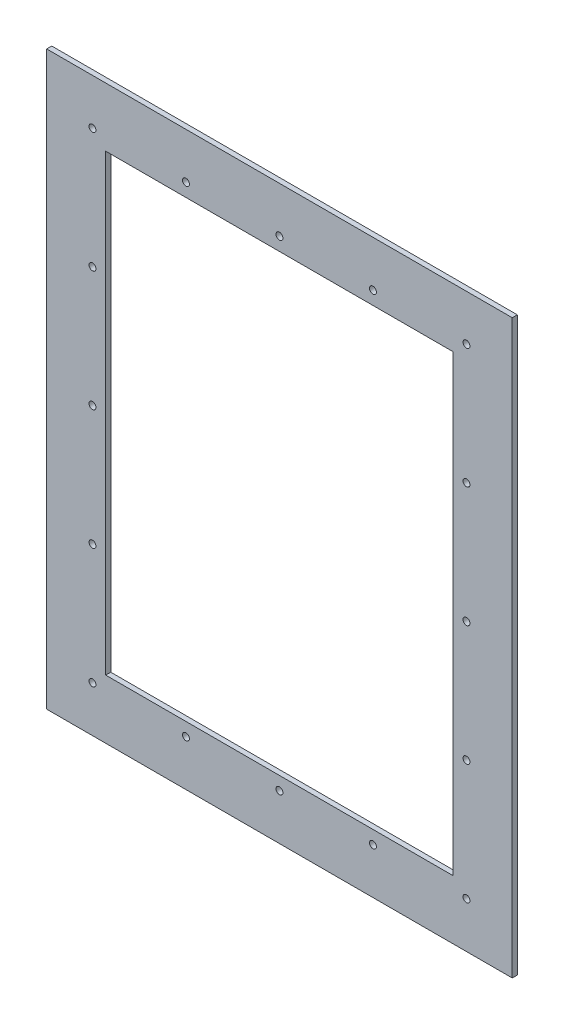
from build123d import *

# Parameters (mm, degrees)
SKETCH1_W           = 276
SKETCH1_H           = 339
SKETCH1_R           = 2.05
SKETCH1_W_2         = 206
SKETCH1_H_2         = 269
BOSS_EXTRUDE1_DEPTH = 3


with BuildPart() as part:
    # Sketch1 → Boss-Extrude1 (new body)
    with BuildSketch(Plane.XY):
        Rectangle(SKETCH1_W, SKETCH1_H)
        with Locations((-110.860879207, 142.360879207)):
            Circle(SKETCH1_R, mode=Mode.SUBTRACT)
        with Locations((-55.430439603, 142.360879207)):
            Circle(SKETCH1_R, mode=Mode.SUBTRACT)
        with Locations((-110.860879207, 71.180439603)):
            Circle(SKETCH1_R, mode=Mode.SUBTRACT)
        with Locations(Location((-55.430439603, -142.360879207, 0), (0, 0, 180))):
            Circle(SKETCH1_R, mode=Mode.SUBTRACT)
        with Locations(Location((-110.860879207, -142.360879207, 0), (0, 0, 180))):
            Circle(SKETCH1_R, mode=Mode.SUBTRACT)
        with Locations(Location((-110.860879207, -71.180439603, 0), (0, 0, 180))):
            Circle(SKETCH1_R, mode=Mode.SUBTRACT)
        with Locations(Location((55.430439603, 142.360879207, 0), (0, 0, 180))):
            Circle(SKETCH1_R, mode=Mode.SUBTRACT)
        with Locations(Location((110.860879207, 142.360879207, 0), (0, 0, 180))):
            Circle(SKETCH1_R, mode=Mode.SUBTRACT)
        with Locations(Location((110.860879207, 71.180439603, 0), (0, 0, 180))):
            Circle(SKETCH1_R, mode=Mode.SUBTRACT)
        with Locations((55.430439603, -142.360879207)):
            Circle(SKETCH1_R, mode=Mode.SUBTRACT)
        with Locations((110.860879207, -142.360879207)):
            Circle(SKETCH1_R, mode=Mode.SUBTRACT)
        with Locations((110.860879207, -71.180439603)):
            Circle(SKETCH1_R, mode=Mode.SUBTRACT)
        with Locations((-110.860879207, 0)):
            Circle(SKETCH1_R, mode=Mode.SUBTRACT)
        with Locations(Location((110.860879207, 0, 0), (0, 0, 180))):
            Circle(SKETCH1_R, mode=Mode.SUBTRACT)
        with Locations((0, 142.360879207)):
            Circle(SKETCH1_R, mode=Mode.SUBTRACT)
        with Locations(Location((0, -142.360879207, 0), (0, 0, 180))):
            Circle(SKETCH1_R, mode=Mode.SUBTRACT)
        Rectangle(SKETCH1_W_2, SKETCH1_H_2, mode=Mode.SUBTRACT)
    extrude(amount=BOSS_EXTRUDE1_DEPTH)


solid = part.part
